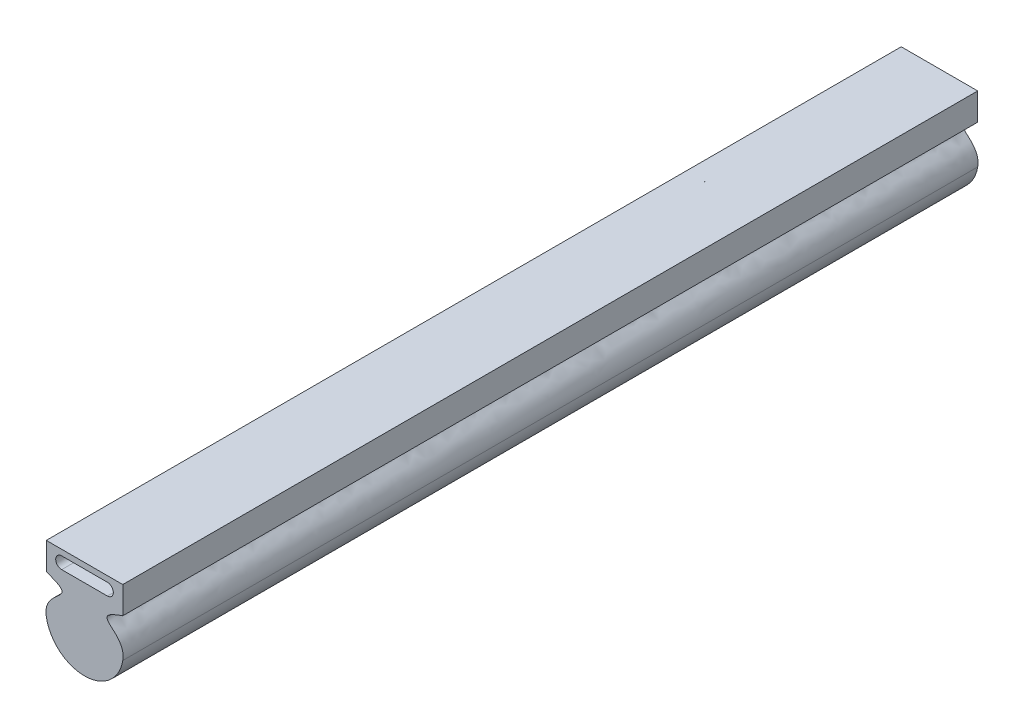
from build123d import *

# Parameters (mm, degrees)
BOSS_EXTRU_1_DEPTH = 313


with BuildPart() as part:
    # Esquisse1 → Boss.-Extru.1 (new body)
    with BuildSketch(Plane.XY):
        with BuildLine():
            Line((-14, 0), (14, 0))
            Line((14, 0), (14, -9.913263158))
            add(Edge.make_bspline(
                [(14, -9.913263158), (0.278502062, -14.553498897), (15.550273166, -14.609095678), (14, -24.101052632)],
                knots=[0, 0, 0, 0, 1, 1, 1, 1], degree=3))
            ThreePointArc((14, -24.101052632), (0, -36), (-14, -24.101052632))
            add(Edge.make_bspline(
                [(-14, -9.913263158), (-0.278502062, -14.553498897), (-15.550273166, -14.609095678), (-14, -24.101052632)],
                knots=[0, 0, 0, 0, 1, 1, 1, 1], degree=3))
            Line((-14, -9.913263158), (-14, 0))
        make_face()
        with BuildLine():
            Line((-8.367157895, -2.097271975), (8.367157895, -2.097271975))
            ThreePointArc((8.367157895, -2.097271975), (10.547051834, -4.277165914), (8.367157895, -6.457059853))
            Line((8.367157895, -6.457059853), (-8.367157895, -6.457059853))
            ThreePointArc((-8.367157895, -6.457059853), (-10.547051834, -4.277165914), (-8.367157895, -2.097271975))
        make_face(mode=Mode.SUBTRACT)
    extrude(amount=BOSS_EXTRU_1_DEPTH)


solid = part.part
